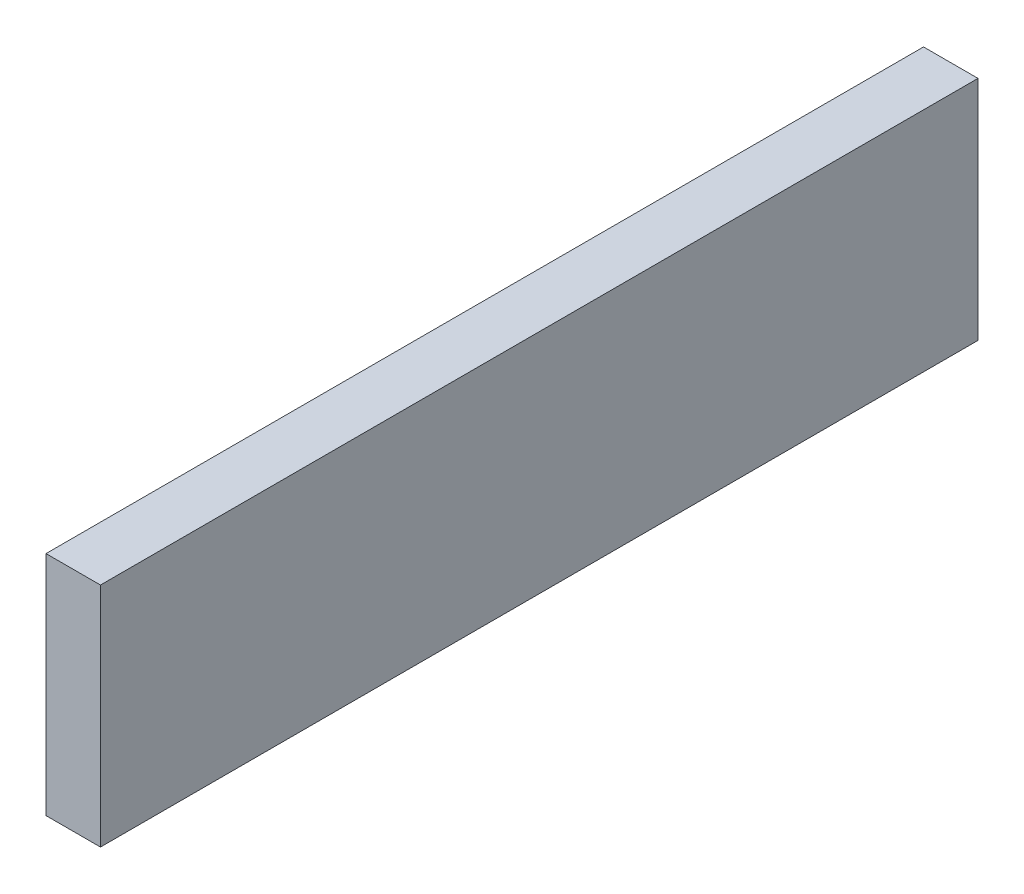
from build123d import *

# Parameters (mm, degrees)
SKETCH1_W           = 290
SKETCH1_H           = 75
BOSS_EXTRUDE1_DEPTH = 9


with BuildPart() as part:
    # Sketch1 → Boss-Extrude1 (new, symmetric)
    with BuildSketch(Plane(origin=(0, 0, 0), x_dir=(0, 0, -1), z_dir=(1, 0, 0))):
        Rectangle(SKETCH1_W, SKETCH1_H)
    extrude(amount=BOSS_EXTRUDE1_DEPTH, both=True)


solid = part.part
